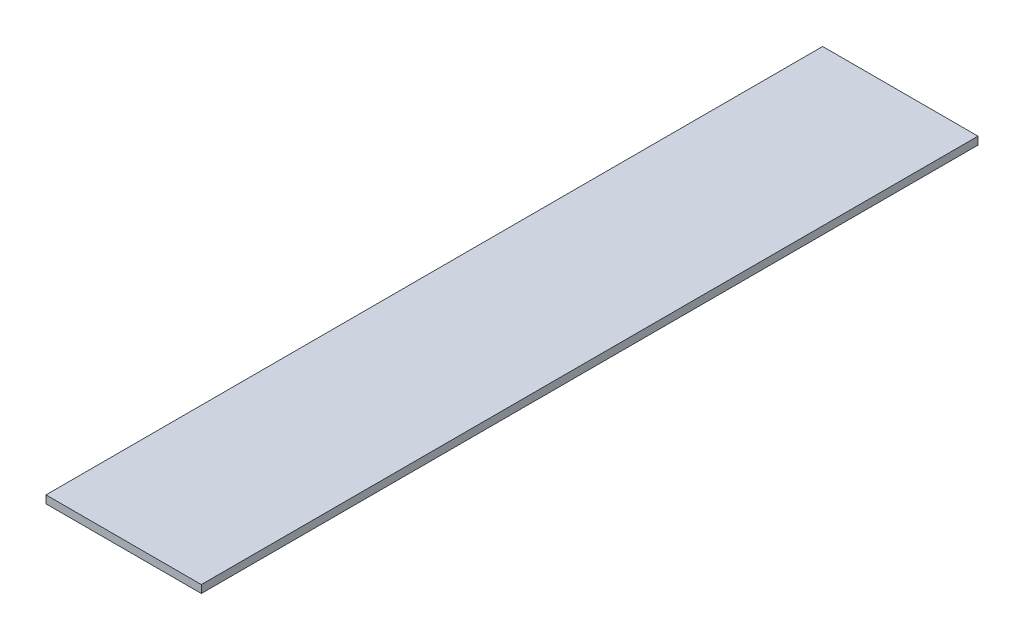
from build123d import *

# Parameters (mm, degrees)
ESQUISSE1_W        = 40
ESQUISSE1_H        = 200
BOSS_EXTRU_1_DEPTH = 2


with BuildPart() as part:
    # Esquisse1 → Boss.-Extru.1 (new body)
    with BuildSketch(Plane(origin=(0, 0, 0), x_dir=(1, 0, 0), z_dir=(0, 1, 0))):
        with Locations((20, 100)):
            Rectangle(ESQUISSE1_W, ESQUISSE1_H)
    extrude(amount=BOSS_EXTRU_1_DEPTH)


solid = part.part
